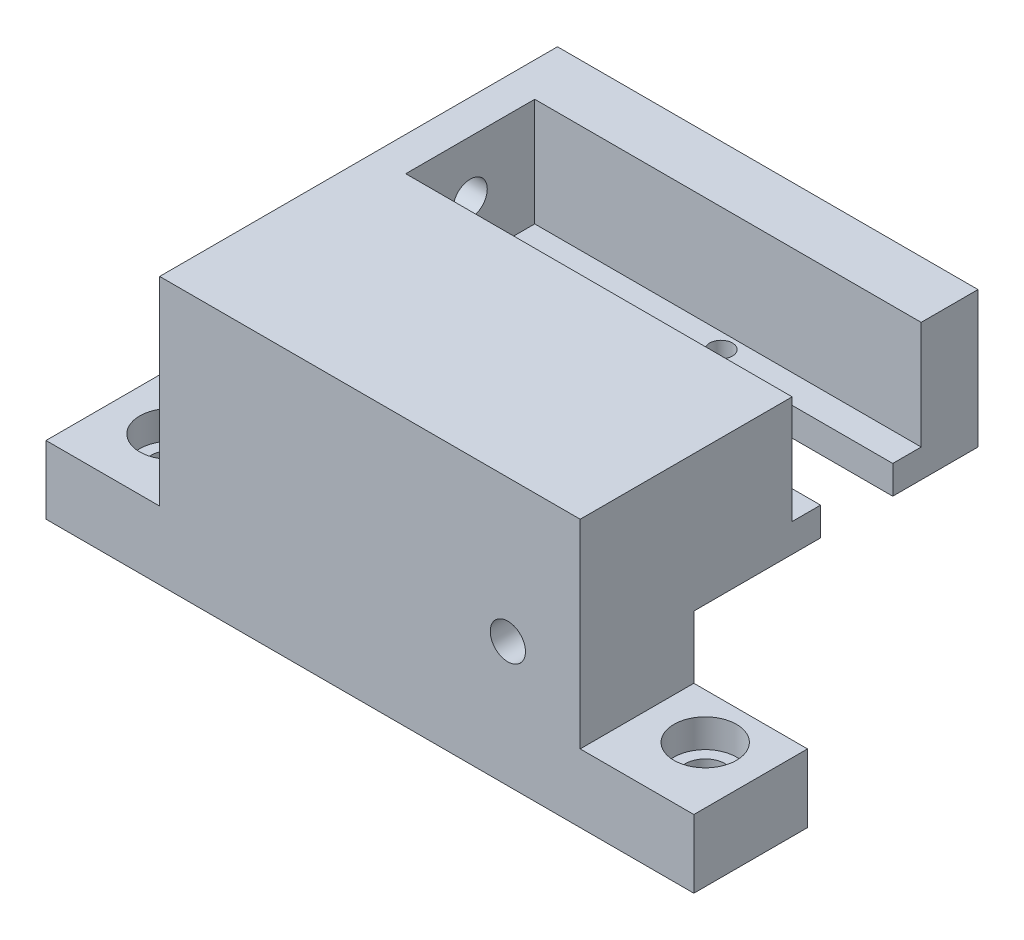
from build123d import *

# Parameters (mm, degrees)
SKETCH1_W                                  = 74
SKETCH1_H                                  = 70
BOSS_EXTRUDE1_DEPTH                        = 47
SKETCH2_W                                  = 22.7
SKETCH2_H                                  = 19
CUT_EXTRUDE1_DEPTH                         = 68
SKETCH7_W                                  = 50
SKETCH7_H                                  = 23
CUT_EXTRUDE4_DEPTH                         = 50
SKETCH8_R                                  = 3.1
CUT_EXTRUDE5_DEPTH                         = 25
SKETCH9_W                                  = 20
SKETCH9_H                                  = 12
BOSS_EXTRUDE3_DEPTH                        = 20
SKETCH10_W                                 = 70
SKETCH10_H                                 = 12
BOSS_EXTRUDE4_DEPTH                        = 20
SKETCH12_R                                 = 3.5
CUT_EXTRUDE6_DEPTH                         = 20
MIRROR1_AT_THE_SECOND_PLANE_COPY_1_SKETC_R = 3.5
MIRROR1_AT_THE_SECOND_PLANE_COPY_1_DEPTH   = 20
SKETCH13_R                                 = 5.5
CUT_EXTRUDE7_DEPTH                         = 5
SKETCH14_R                                 = 3
CUT_EXTRUDE8_DEPTH                         = 10
SKETCH15_W                                 = 12.7
SKETCH15_H                                 = 5
CUT_EXTRUDE9_DEPTH                         = 20
SKETCH16_R                                 = 2
CUT_EXTRUDE10_DEPTH                        = 73.512067961


with BuildPart() as part:
    # Sketch1 → Boss-Extrude1 (new body)
    with BuildSketch(Plane(origin=(0, 0, 0), x_dir=(1, 0, 0), z_dir=(0, 1, 0))):
        Rectangle(SKETCH1_W, SKETCH1_H)
    extrude(amount=BOSS_EXTRUDE1_DEPTH)

    # Sketch2 → Cut-Extrude1 (cut)
    with BuildSketch(Plane(origin=(37, 0, 0), x_dir=(0, 0, -1), z_dir=(1, 0, 0))):
        with Locations((13.65, 37.5)):
            Rectangle(SKETCH2_W, SKETCH2_H)
    extrude(amount=-CUT_EXTRUDE1_DEPTH, mode=Mode.SUBTRACT)

    # Sketch7 → Cut-Extrude4 (cut)
    with BuildSketch(Plane(origin=(0, 0, -35), x_dir=(-1, 0, 0), z_dir=(0, 0, -1))):
        with Locations((-12, 11.5)):
            Rectangle(SKETCH7_W, SKETCH7_H)
    extrude(amount=-CUT_EXTRUDE4_DEPTH, mode=Mode.SUBTRACT)

    # Sketch8 → Cut-Extrude5 (cut)
    with BuildSketch(Plane.XY.offset(35)):
        with Locations((24.27, 22)):
            Circle(SKETCH8_R)
    extrude(amount=-CUT_EXTRUDE5_DEPTH, mode=Mode.SUBTRACT)

    # Sketch9 → Boss-Extrude3 (add)
    with BuildSketch(Plane(origin=(37, 0, 0), x_dir=(0, 0, -1), z_dir=(1, 0, 0))):
        with Locations((-25, 6)):
            Rectangle(SKETCH9_W, SKETCH9_H)
    extrude(amount=BOSS_EXTRUDE3_DEPTH)

    # Sketch10 → Boss-Extrude4 (add)
    with BuildSketch(Plane.ZY.offset(37)):
        with Locations((0, 6)):
            Rectangle(SKETCH10_W, SKETCH10_H)
    extrude(amount=BOSS_EXTRUDE4_DEPTH)

    # Sketch12 → Cut-Extrude6 (cut)
    with BuildSketch(Plane(origin=(0, 12, 0), x_dir=(1, 0, 0), z_dir=(0, 1, 0))):
        with Locations(Location((-47, 23, 0), (0, 0, 270))):
            Circle(SKETCH12_R)
    cut_extrude6 = extrude(amount=-CUT_EXTRUDE6_DEPTH, mode=Mode.SUBTRACT)

    # Mirror1: Cut-Extrude6 across plane
    add(cut_extrude6.mirror(Plane.XY), mode=Mode.SUBTRACT)

    # Mirror1 at the second plane: Cut-Extrude6 across plane
    add(cut_extrude6.mirror(Plane(origin=(0, 0, 0), x_dir=(0, 0, 1), z_dir=(1, 0, 0))), mode=Mode.SUBTRACT)

    # Mirror1 at the second plane copy 1 sketc → Mirror1 at the second plane copy 1 (cut)
    with BuildSketch(Plane(origin=(0, 12, 0), x_dir=(-1, 0, 0), z_dir=(0, 1, 0))):
        with Locations(Location((-47, 23, 0), (0, 0, 270))):
            Circle(MIRROR1_AT_THE_SECOND_PLANE_COPY_1_SKETC_R)
    extrude(amount=-MIRROR1_AT_THE_SECOND_PLANE_COPY_1_DEPTH, mode=Mode.SUBTRACT)

    # Sketch13 → Cut-Extrude7 (cut)
    with BuildSketch(Plane(origin=(0, 12, 0), x_dir=(1, 0, 0), z_dir=(0, 1, 0))):
        with Locations(Location((-47, -23, 0), (0, 0, 270))):
            Circle(SKETCH13_R)
    cut_extrude7 = extrude(amount=-CUT_EXTRUDE7_DEPTH, mode=Mode.SUBTRACT)

    # Mirror2: Cut-Extrude7 across plane
    add(cut_extrude7.mirror(Plane.XY), mode=Mode.SUBTRACT)

    # Mirror2 at the second plane: Cut-Extrude7 across plane
    add(cut_extrude7.mirror(Plane(origin=(0, 0, 0), x_dir=(0, 0, 1), z_dir=(1, 0, 0))), mode=Mode.SUBTRACT)

    # Sketch14 → Cut-Extrude8 (cut)
    with BuildSketch(Plane(origin=(-31, 0, 0), x_dir=(0, 0, -1), z_dir=(1, 0, 0))):
        with Locations((13.65, 37.5)):
            Circle(SKETCH14_R)
    extrude(amount=-CUT_EXTRUDE8_DEPTH, mode=Mode.SUBTRACT)

    # Sketch15 → Cut-Extrude9 (cut)
    with BuildSketch(Plane(origin=(37, 0, 0), x_dir=(0, 0, -1), z_dir=(1, 0, 0))):
        with Locations((13.65, 25.5)):
            Rectangle(SKETCH15_W, SKETCH15_H)
    extrude(amount=-CUT_EXTRUDE9_DEPTH, mode=Mode.SUBTRACT)

    # Sketch16 → Cut-Extrude10 (cut, through all)
    with BuildSketch(Plane(origin=(0, 28, 0), x_dir=(1, 0, 0), z_dir=(0, 1, 0))):
        with Locations(Location((4.53, 5.05, 0), (0, 0, 270))):
            Circle(SKETCH16_R)
        with Locations(Location((4.53, 22.25, 0), (0, 0, 270))):
            Circle(SKETCH16_R)
    extrude(amount=-CUT_EXTRUDE10_DEPTH, mode=Mode.SUBTRACT)


solid = part.part
